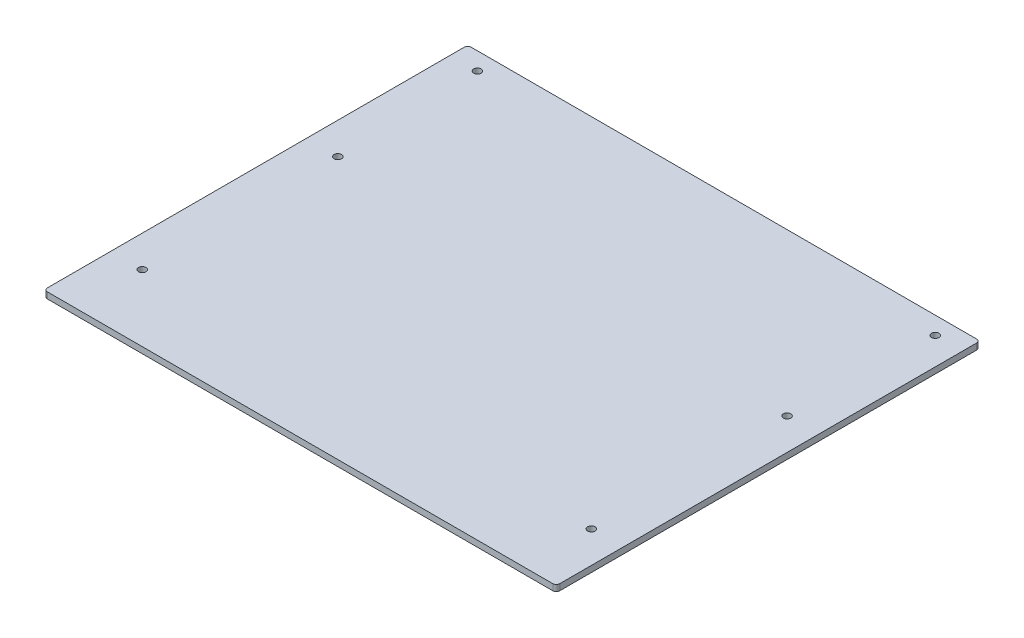
from build123d import *

# Parameters (mm, degrees)
SKETCH1_W           = 463.55
SKETCH1_H           = 383.413
SKETCH1_R           = 3.3782
BOSS_EXTRUDE1_DEPTH = 5.588
FILLET1_R           = 3.175
SKETCH2_R           = 3.3782
CUT_EXTRUDE1_DEPTH  = 602.594013279


with BuildPart() as part:
    # Sketch1 → Boss-Extrude1 (new body)
    with BuildSketch(Plane(origin=(0, 0, 0), x_dir=(1, 0, 0), z_dir=(0, 1, 0))):
        with Locations((231.775, 191.7065)):
            Rectangle(SKETCH1_W, SKETCH1_H)
        with Locations(Location((28.575, 60.325, 0), (0, 0, 270))):
            Circle(SKETCH1_R, mode=Mode.SUBTRACT)
        with Locations(Location((28.575, 237.363, 0), (0, 0, 270))):
            Circle(SKETCH1_R, mode=Mode.SUBTRACT)
        with Locations(Location((434.975, 237.363, 0), (0, 0, 90))):
            Circle(SKETCH1_R, mode=Mode.SUBTRACT)
        with Locations(Location((434.975, 60.325, 0), (0, 0, 90))):
            Circle(SKETCH1_R, mode=Mode.SUBTRACT)
    extrude(amount=BOSS_EXTRUDE1_DEPTH)

    # Fillet1
    fillet1_edges = [part.edges().sort_by_distance(p)[0] for p in [
        (0, 2.794, -383.413),
        (463.55, 2.794, -383.413),
        (463.55, 2.794, 0),
        (0, 2.794, 0),
    ]]
    fillet(fillet1_edges, radius=FILLET1_R)

    # Sketch2 → Cut-Extrude1 (cut, through all)
    with BuildSketch(Plane(origin=(0, 5.588, 0), x_dir=(1, 0, 0), z_dir=(0, 1, 0))):
        with Locations(Location((24.638, 367.538, 0), (0, 0, 270))):
            Circle(SKETCH2_R)
        with Locations(Location((438.912, 367.538, 0), (0, 0, 90))):
            Circle(SKETCH2_R)
    extrude(amount=-CUT_EXTRUDE1_DEPTH, mode=Mode.SUBTRACT)


solid = part.part
